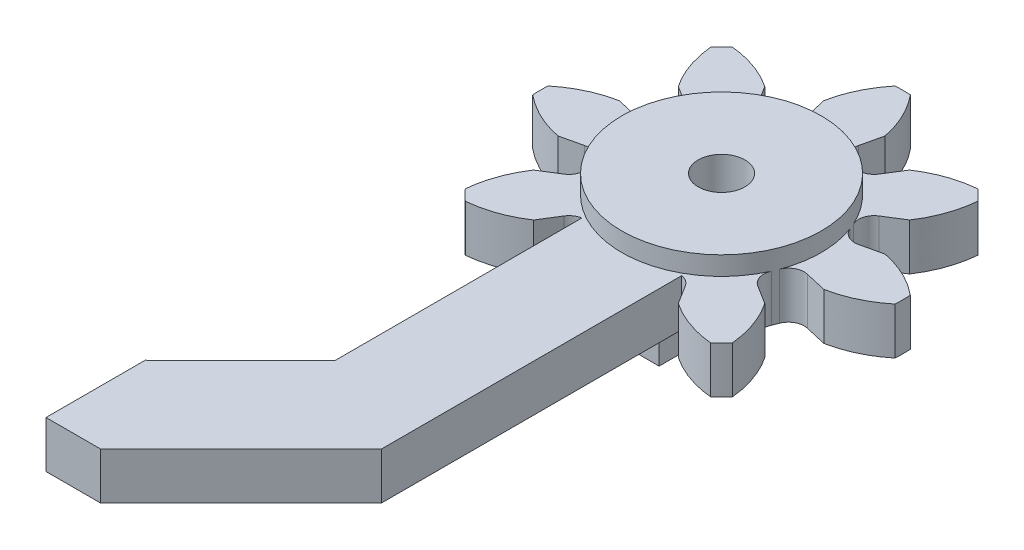
from build123d import *

# Parameters (mm, degrees)
SKETCH1_R           = 6.39375
BOSS_EXTRUDE1_DEPTH = 4.2
BOSS_EXTRUDE2_DEPTH = 3
FILLET1_R           = 1
SKETCH3_R           = 1.5
CUT_EXTRUDE1_DEPTH  = 17.968242557
BOSS_EXTRUDE3_DEPTH = 3
CHAMFER1_SIZE       = 6
CHAMFER2_SIZE       = 9
SKETCH6_W           = 5
SKETCH6_H           = 3
BOSS_EXTRUDE4_DEPTH = 2


with BuildPart() as part:
    # Sketch1 → Boss-Extrude1 (new body)
    with BuildSketch(Plane(origin=(0, 0, 0), x_dir=(1, 0, 0), z_dir=(0, 1, 0))):
        with Locations(Location((0, 0, 0), (0, 0, 270))):
            Circle(SKETCH1_R)
    extrude(amount=BOSS_EXTRUDE1_DEPTH)

    # Sketch2 → Boss-Extrude2 (add)
    with BuildSketch(Plane(origin=(0, 0, 0), x_dir=(1, 0, 0), z_dir=(0, 1, 0))):
        with BuildLine():
            Line((-1.433648629, 6.23094621), (-1.959549626, 8.516625387))
            add(Edge.make_bspline(
                [(-1.959549626, 8.516625387), (-1.745269759, 9.644412797), (-1.223586565, 10.731441367), (-0.488991141, 11.614711045)],
                knots=[0, 0, 0, 0, 1, 1, 1, 1], degree=3))
            ThreePointArc((-0.488991141, 11.614711045), (0, 11.625), (0.488991141, 11.614711045))
            add(Edge.make_bspline(
                [(1.959549626, 8.516625387), (1.745269759, 9.644412797), (1.223586565, 10.731441367), (0.488991141, 11.614711045)],
                knots=[0, 0, 0, 0, 1, 1, 1, 1], degree=3))
            Line((1.959549626, 8.516625387), (1.433648629, 6.23094621))
            ThreePointArc((1.433648629, 6.23094621), (0, 6.39375), (-1.433648629, 6.23094621))
        make_face()
        with BuildLine():
            Line((3.392201651, 5.419686986), (4.636552736, 7.407774392))
            add(Edge.make_bspline(
                [(4.636552736, 7.407774392), (5.585537608, 8.053721771), (6.723068605, 8.45348132), (7.86707199, 8.558609894)],
                knots=[0, 0, 0, 0, 1, 1, 1, 1], degree=3))
            ThreePointArc((7.86707199, 8.558609894), (8.220116331, 8.220116331), (8.558609894, 7.86707199))
            add(Edge.make_bspline(
                [(7.407774392, 4.636552736), (8.053721771, 5.585537608), (8.45348132, 6.723068605), (8.558609894, 7.86707199)],
                knots=[0, 0, 0, 0, 1, 1, 1, 1], degree=3))
            Line((7.407774392, 4.636552736), (5.419686986, 3.392201651))
            ThreePointArc((5.419686986, 3.392201651), (4.521063982, 4.521063982), (3.392201651, 5.419686986))
        make_face()
        with BuildLine():
            Line((6.23094621, 1.433648629), (8.516625387, 1.959549626))
            add(Edge.make_bspline(
                [(8.516625387, 1.959549626), (9.644412797, 1.745269759), (10.731441367, 1.223586565), (11.614711045, 0.488991141)],
                knots=[0, 0, 0, 0, 1, 1, 1, 1], degree=3))
            ThreePointArc((11.614711045, 0.488991141), (11.625, 0), (11.614711045, -0.488991141))
            add(Edge.make_bspline(
                [(8.516625387, -1.959549626), (9.644412797, -1.745269759), (10.731441367, -1.223586565), (11.614711045, -0.488991141)],
                knots=[0, 0, 0, 0, 1, 1, 1, 1], degree=3))
            Line((8.516625387, -1.959549626), (6.23094621, -1.433648629))
            ThreePointArc((6.23094621, -1.433648629), (6.39375, 0), (6.23094621, 1.433648629))
        make_face()
        with BuildLine():
            Line((5.419686986, -3.392201651), (7.407774392, -4.636552736))
            add(Edge.make_bspline(
                [(7.407774392, -4.636552736), (8.053721771, -5.585537608), (8.45348132, -6.723068605), (8.558609894, -7.86707199)],
                knots=[0, 0, 0, 0, 1, 1, 1, 1], degree=3))
            ThreePointArc((8.558609894, -7.86707199), (8.220116331, -8.220116331), (7.86707199, -8.558609894))
            add(Edge.make_bspline(
                [(4.636552736, -7.407774392), (5.585537608, -8.053721771), (6.723068605, -8.45348132), (7.86707199, -8.558609894)],
                knots=[0, 0, 0, 0, 1, 1, 1, 1], degree=3))
            Line((4.636552736, -7.407774392), (3.392201651, -5.419686986))
            ThreePointArc((3.392201651, -5.419686986), (4.521063982, -4.521063982), (5.419686986, -3.392201651))
        make_face()
        with BuildLine():
            Line((1.433648629, -6.23094621), (1.959549626, -8.516625387))
            add(Edge.make_bspline(
                [(1.959549626, -8.516625387), (1.745269759, -9.644412797), (1.223586565, -10.731441367), (0.488991141, -11.614711045)],
                knots=[0, 0, 0, 0, 1, 1, 1, 1], degree=3))
            ThreePointArc((0.488991141, -11.614711045), (0, -11.625), (-0.488991141, -11.614711045))
            add(Edge.make_bspline(
                [(-1.959549626, -8.516625387), (-1.745269759, -9.644412797), (-1.223586565, -10.731441367), (-0.488991141, -11.614711045)],
                knots=[0, 0, 0, 0, 1, 1, 1, 1], degree=3))
            Line((-1.959549626, -8.516625387), (-1.433648629, -6.23094621))
            ThreePointArc((-1.433648629, -6.23094621), (0, -6.39375), (1.433648629, -6.23094621))
        make_face()
        with BuildLine():
            Line((-3.392201651, -5.419686986), (-4.636552736, -7.407774392))
            add(Edge.make_bspline(
                [(-4.636552736, -7.407774392), (-5.585537608, -8.053721771), (-6.723068605, -8.45348132), (-7.86707199, -8.558609894)],
                knots=[0, 0, 0, 0, 1, 1, 1, 1], degree=3))
            ThreePointArc((-7.86707199, -8.558609894), (-8.220116331, -8.220116331), (-8.558609894, -7.86707199))
            add(Edge.make_bspline(
                [(-7.407774392, -4.636552736), (-8.053721771, -5.585537608), (-8.45348132, -6.723068605), (-8.558609894, -7.86707199)],
                knots=[0, 0, 0, 0, 1, 1, 1, 1], degree=3))
            Line((-7.407774392, -4.636552736), (-5.419686986, -3.392201651))
            ThreePointArc((-5.419686986, -3.392201651), (-4.521063982, -4.521063982), (-3.392201651, -5.419686986))
        make_face()
        with BuildLine():
            Line((-6.23094621, -1.433648629), (-8.516625387, -1.959549626))
            add(Edge.make_bspline(
                [(-8.516625387, -1.959549626), (-9.644412797, -1.745269759), (-10.731441367, -1.223586565), (-11.614711045, -0.488991141)],
                knots=[0, 0, 0, 0, 1, 1, 1, 1], degree=3))
            ThreePointArc((-11.614711045, -0.488991141), (-11.625, 0), (-11.614711045, 0.488991141))
            add(Edge.make_bspline(
                [(-8.516625387, 1.959549626), (-9.644412797, 1.745269759), (-10.731441367, 1.223586565), (-11.614711045, 0.488991141)],
                knots=[0, 0, 0, 0, 1, 1, 1, 1], degree=3))
            Line((-8.516625387, 1.959549626), (-6.23094621, 1.433648629))
            ThreePointArc((-6.23094621, 1.433648629), (-6.39375, 0), (-6.23094621, -1.433648629))
        make_face()
        with BuildLine():
            Line((-5.419686986, 3.392201651), (-7.407774392, 4.636552736))
            add(Edge.make_bspline(
                [(-7.407774392, 4.636552736), (-8.053721771, 5.585537608), (-8.45348132, 6.723068605), (-8.558609894, 7.86707199)],
                knots=[0, 0, 0, 0, 1, 1, 1, 1], degree=3))
            ThreePointArc((-8.558609894, 7.86707199), (-8.220116331, 8.220116331), (-7.86707199, 8.558609894))
            add(Edge.make_bspline(
                [(-4.636552736, 7.407774392), (-5.585537608, 8.053721771), (-6.723068605, 8.45348132), (-7.86707199, 8.558609894)],
                knots=[0, 0, 0, 0, 1, 1, 1, 1], degree=3))
            Line((-4.636552736, 7.407774392), (-3.392201651, 5.419686986))
            ThreePointArc((-3.392201651, 5.419686986), (-4.521063982, 4.521063982), (-5.419686986, 3.392201651))
        make_face()
    extrude(amount=BOSS_EXTRUDE2_DEPTH)

    # Fillet1
    fillet1_edges = [part.edges().sort_by_distance(p)[0] for p in [
        (-5.419686986, 1.5, -3.392201651),
        (-3.392201651, 1.5, -5.419686986),
        (3.392201651, 1.5, -5.419686986),
        (5.419686986, 1.5, -3.392201651),
        (6.23094621, 1.5, -1.433648629),
        (6.23094621, 1.5, 1.433648629),
        (5.419686986, 1.5, 3.392201651),
        (3.392201651, 1.5, 5.419686986),
        (1.433648629, 1.5, 6.23094621),
        (-1.433648629, 1.5, 6.23094621),
        (-3.392201651, 1.5, 5.419686986),
        (-5.419686986, 1.5, 3.392201651),
        (-1.433648629, 1.5, -6.23094621),
        (1.433648629, 1.5, -6.23094621),
        (-6.23094621, 1.5, 1.433648629),
        (-6.23094621, 1.5, -1.433648629),
    ]]
    fillet(fillet1_edges, radius=FILLET1_R)

    # Sketch3 → Cut-Extrude1 (cut, through all)
    with BuildSketch(Plane(origin=(0, 4.2, 0), x_dir=(1, 0, 0), z_dir=(0, 1, 0))):
        with Locations(Location((0, 0, 0), (0, 0, 270))):
            Circle(SKETCH3_R)
    extrude(amount=-CUT_EXTRUDE1_DEPTH, mode=Mode.SUBTRACT)

    # Sketch5 → Boss-Extrude3 (add)
    with BuildSketch(Plane.XZ):
        Polygon((-3.2, 4), (3.2, 4), (3.2, 34), (-9.3, 34), (-9.3, 27.6), (-3.2, 27.6), align=None)
    extrude(amount=-BOSS_EXTRUDE3_DEPTH)

    # Chamfer1
    chamfer1_edges = [part.edges().sort_by_distance(p)[0] for p in [
        (-3.2, 1.5, 27.6),
    ]]
    chamfer(chamfer1_edges, length=CHAMFER1_SIZE)

    # Chamfer2
    chamfer2_edges = [part.edges().sort_by_distance(p)[0] for p in [
        (3.2, 1.5, 34),
    ]]
    chamfer(chamfer2_edges, length=CHAMFER2_SIZE)

    # Sketch6 → Boss-Extrude4 (add)
    with BuildSketch(Plane.XZ):
        with Locations((0, -5)):
            Rectangle(SKETCH6_W, SKETCH6_H)
        with Locations((0, 5)):
            Rectangle(SKETCH6_W, SKETCH6_H)
    extrude(amount=BOSS_EXTRUDE4_DEPTH)


solid = part.part
